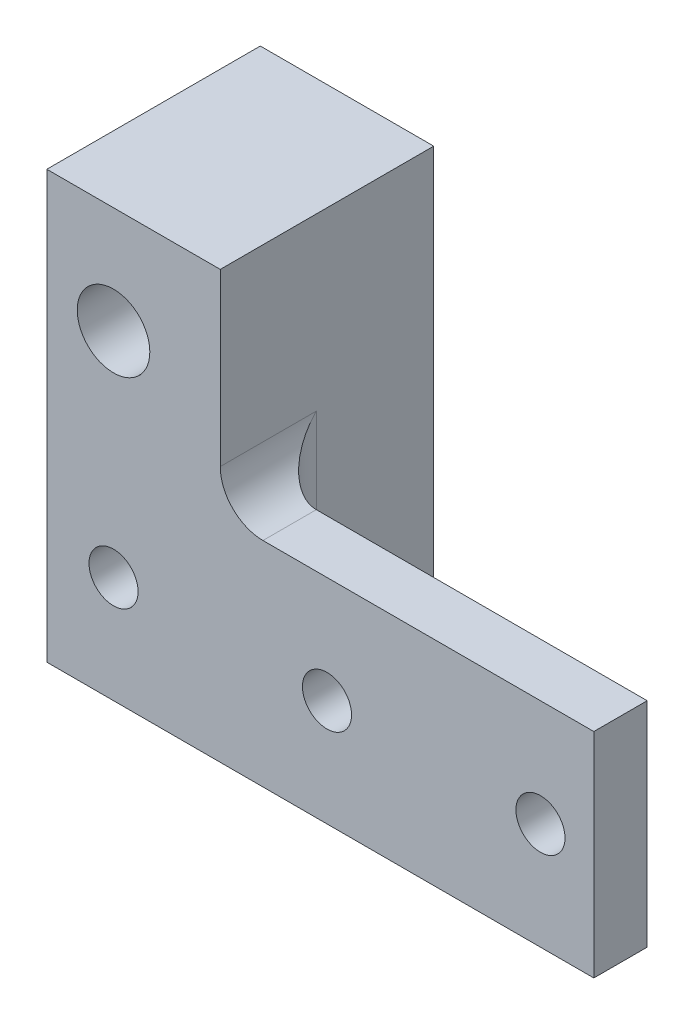
from build123d import *

# Parameters (mm, degrees)
BOSS_EXTRUDE1_DEPTH = 25.4
SKETCH2_R           = 2.921
CUT_EXTRUDE1_DEPTH  = 91.02678768
SKETCH3_W           = 4.7625
SKETCH3_H           = 50.8
CUT_EXTRUDE2_DEPTH  = 91.02678768
SKETCH4_W           = 44.45
SKETCH4_H           = 19.05
CUT_EXTRUDE3_DEPTH  = 91.02678768
FILLET1_R           = 5.08
SKETCH6_R           = 4.318
CUT_EXTRUDE5_DEPTH  = 12.7


with BuildPart() as part:
    # Sketch1 → Boss-Extrude1 (new body)
    with BuildSketch(Plane.XY):
        Polygon((0, 0), (0, 50.8), (25.4, 50.8), (25.4, 25.4), (69.85, 25.4), (69.85, 0), align=None)
    extrude(amount=BOSS_EXTRUDE1_DEPTH)

    # Sketch2 → Cut-Extrude1 (cut, through all)
    with BuildSketch(Plane.XY.offset(25.4)):
        with Locations((12.7, 38.1)):
            Circle(SKETCH2_R)
        with Locations((12.7, 12.7)):
            Circle(SKETCH2_R)
        with Locations((38.1, 12.7)):
            Circle(SKETCH2_R)
        with Locations((63.5, 12.7)):
            Circle(SKETCH2_R)
    extrude(amount=-CUT_EXTRUDE1_DEPTH, mode=Mode.SUBTRACT)

    # Sketch3 → Cut-Extrude2 (cut, through all)
    with BuildSketch(Plane.XY.offset(25.4)):
        with Locations((2.38125, 25.4)):
            Rectangle(SKETCH3_W, SKETCH3_H)
    extrude(amount=-CUT_EXTRUDE2_DEPTH, mode=Mode.SUBTRACT)

    # Sketch4 → Cut-Extrude3 (cut, through all)
    with BuildSketch(Plane.XZ):
        with Locations((47.625, 9.525)):
            Rectangle(SKETCH4_W, SKETCH4_H)
    extrude(amount=-CUT_EXTRUDE3_DEPTH, mode=Mode.SUBTRACT)

    # Fillet1
    fillet1_edges = [part.edges().sort_by_distance(p)[0] for p in [
        (25.4, 25.4, 22.225),
        (25.4, 12.7, 19.05),
    ]]
    fillet(fillet1_edges, radius=FILLET1_R)

    # Sketch6 → Cut-Extrude5 (cut)
    with BuildSketch(Plane.XY.offset(25.4)):
        with Locations((12.7, 38.1)):
            Circle(SKETCH6_R)
    extrude(amount=-CUT_EXTRUDE5_DEPTH, mode=Mode.SUBTRACT)


solid = part.part
